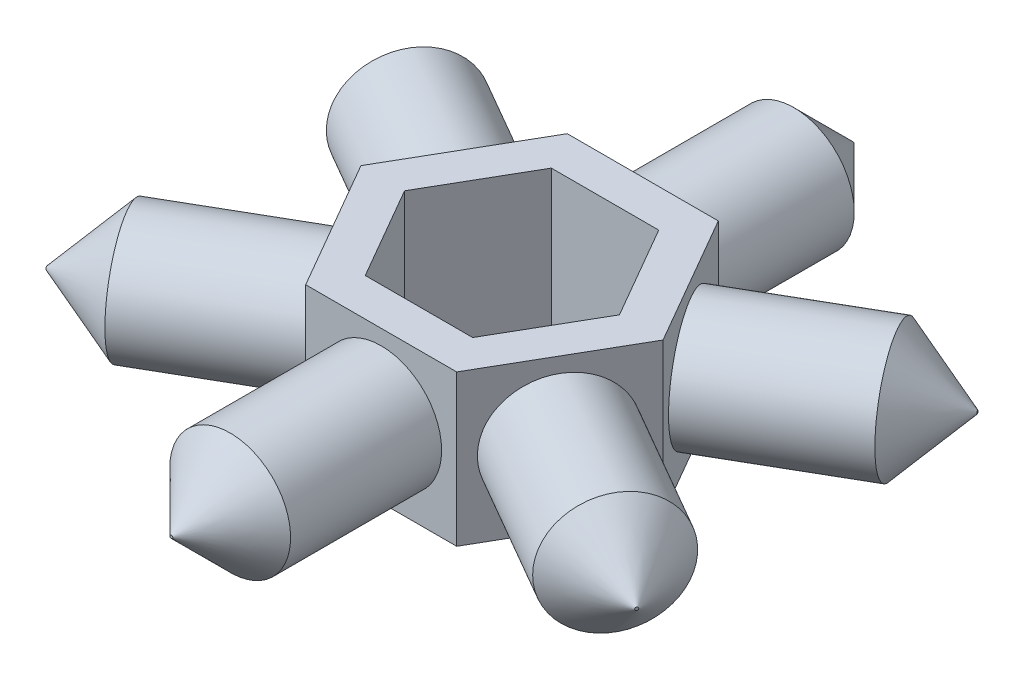
from build123d import *

# Parameters (mm, degrees)
BOSS_EXTRUDE1_DEPTH     = 5
SKETCH2_R               = 4
BOSS_EXTRUDE2_DEPTH     = 10
SKETCH6_R               = 4
BOSS_EXTRUDE3_DEPTH     = 10
MIRROR2_COPY_1_SKETCH_R = 4
MIRROR2_COPY_1_DEPTH    = 10
MIRROR2_COPY_3_SKETCH_R = 4
MIRROR2_COPY_3_DEPTH    = 10


with BuildPart() as part:
    # Sketch1 → Boss-Extrude1 (new, symmetric)
    with BuildSketch(Plane(origin=(0, 0, 0), x_dir=(1, 0, 0), z_dir=(0, 1, 0))):
        Polygon((5, 8.660254038), (-5, 8.660254038), (-10, 0), (-5, -8.660254038), (5, -8.660254038), (10, 0), align=None)
        Polygon((-7.113248654, 0), (-3.556624327, -6.160254038), (3.556624327, -6.160254038), (7.113248654, 0), (3.556624327, 6.160254038), (-3.556624327, 6.160254038), align=None, mode=Mode.SUBTRACT)
    extrude(amount=BOSS_EXTRUDE1_DEPTH, both=True)

    # Sketch2 → Boss-Extrude2 (add)
    with BuildSketch(Plane(origin=(0, 0, -8.660254038), x_dir=(-1, 0, 0), z_dir=(0, 0, -1))):
        Circle(SKETCH2_R)
    extrude(amount=BOSS_EXTRUDE2_DEPTH)

    # Sketch3 → Revolve1 (revolve)
    with BuildSketch(Plane(origin=(0, 0, 0), x_dir=(0, 0, -1), z_dir=(1, 0, 0)), mode=Mode.PRIVATE) as revolve1_sk:
        Polygon((18.660254038, 4), (22.560254038, 0.1), (22.560254038, 0), (18.660254038, 0), align=None)
    revolve(revolve1_sk.sketch.rotate(Axis((0, 0, 981.339745962), (0, 0, -1)), 90), axis=Axis((0, 0, 981.339745962), (0, 0, -1)))

    # Sketch6 → Boss-Extrude3 (add)
    with BuildSketch(Plane(origin=(7.5, 0, -4.330127019), x_dir=(-0.49999999999999983, 0, -0.8660254037844388), z_dir=(0.8660254037844387, 0, -0.4999999999999998))):
        with Locations(Location((0, 0, 0), (0, 0, 180))):
            Circle(SKETCH6_R)
    boss_extrude3 = extrude(amount=BOSS_EXTRUDE3_DEPTH)

    # Sketch9 → Revolve4 (revolve)
    with BuildSketch(Plane(origin=(0, 0, 0), x_dir=(1, 0, 0), z_dir=(0, 1, 0)), mode=Mode.PRIVATE) as revolve4_sk:
        Polygon((14.160254038, 12.794228634), (19.487753113, 11.366729559), (19.537753113, 11.280127019), (16.160254038, 9.330127019), align=None)
    revolve4 = revolve(revolve4_sk.sketch.rotate(Axis((0, 0, 0), (0.8660254037844387, 0, -0.5000000000000001)), 180), axis=Axis((0, 0, 0), (0.8660254037844387, 0, -0.5000000000000001)))

    # Sketch10 → Revolve5 (revolve)
    with BuildSketch(Plane(origin=(0, 0, 0), x_dir=(1, 0, 0), z_dir=(0, 1, 0)), mode=Mode.PRIVATE) as revolve5_sk:
        Polygon((9.5, -0.866025404), (18.160254038, -5.866025404), (19.587753113, -11.193524479), (19.537753113, -11.280127019), (7.5, -4.330127019), align=None)
    revolve5 = revolve(revolve5_sk.sketch.rotate(Axis((0, 0, 0), (0.8660254037844387, 0, 0.5)), 180), axis=Axis((0, 0, 0), (0.8660254037844387, 0, 0.5)))

    # Mirror1: Boss-Extrude3, Revolve4 across plane
    add(boss_extrude3.mirror(Plane(origin=(0, 0, 0), x_dir=(0.49999999999999983, 0, 0.8660254037844387), z_dir=(0.8660254037844388, 0, -0.49999999999999983))))
    add(revolve4.mirror(Plane(origin=(0, 0, 0), x_dir=(0.49999999999999983, 0, 0.8660254037844387), z_dir=(0.8660254037844388, 0, -0.49999999999999983))))

    # Mirror2: Revolve5 across plane
    add(revolve5.mirror(Plane(origin=(0, 0, 0), x_dir=(-0.49999999999999983, 0, 0.8660254037844387), z_dir=(0.8660254037844388, 0, 0.49999999999999983))))

    # Mirror2 copy 1 sketch → Mirror2 copy 1 (add)
    with BuildSketch(Plane.XY.offset(8.660254038)):
        with Locations(Location((0, 0, 0), (0, 0, 180))):
            Circle(MIRROR2_COPY_1_SKETCH_R)
    extrude(amount=MIRROR2_COPY_1_DEPTH)

    # Mirror2 copy 2 sketch → Mirror2 copy 2 (revolve)
    with BuildSketch(Plane(origin=(0, 0, 0), x_dir=(-0.499999999999999, 0, 0.8660254037844393), z_dir=(0, 1, 0))):
        Polygon((14.160254038, 12.794228634), (19.487753113, 11.366729559), (19.537753113, 11.280127019), (16.160254038, 9.330127019), align=None)
    revolve(axis=Axis((0, 0, 0), (0, 0, 1)))

    # Mirror2 copy 3 sketch → Mirror2 copy 3 (add)
    with BuildSketch(Plane(origin=(0, 0, -8.660254038), x_dir=(1, 0, 0), z_dir=(0, 0, -1))):
        Circle(MIRROR2_COPY_3_SKETCH_R)
    extrude(amount=MIRROR2_COPY_3_DEPTH)

    # Mirror2 copy 4 sketch → Mirror2 copy 4 (revolve)
    with BuildSketch(Plane(origin=(0, 0, 0), x_dir=(-0.5000000000000007, 0, -0.8660254037844385), z_dir=(0, 1, 0))):
        Polygon((14.160254038, -12.794228634), (19.487753113, -11.366729559), (19.537753113, -11.280127019), (16.160254038, -9.330127019), align=None)
    revolve(axis=Axis((0, 0, 0), (0, 0, 1)))


solid = part.part
